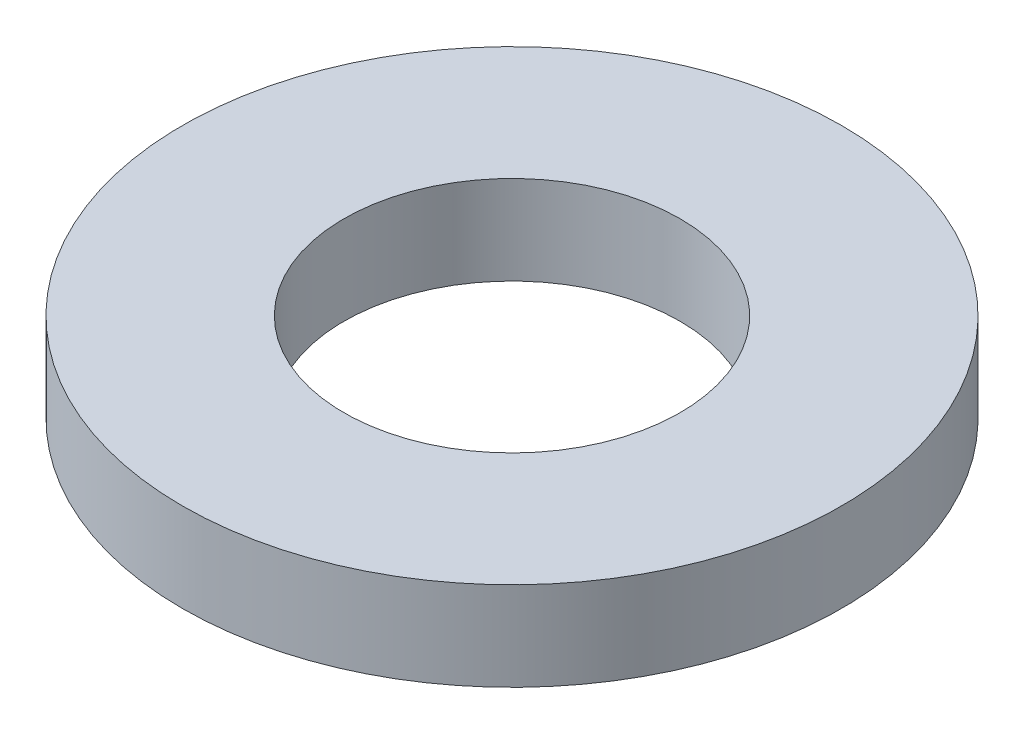
from build123d import *

# Parameters (mm, degrees)
SKETCH1_W = 1.70815
SKETCH1_H = 0.9398


with BuildPart() as part:
    # Sketch1 → Revolve1 (revolve)
    with BuildSketch(Plane.XY, mode=Mode.PRIVATE) as revolve1_sk:
        with Locations((2.632075, 0.4699)):
            Rectangle(SKETCH1_W, SKETCH1_H)
    revolve(revolve1_sk.sketch.rotate(Axis((0, 0.9398, 0), (0, -1, 0)), 270), axis=Axis((0, 0.9398, 0), (0, -1, 0)))


solid = part.part
